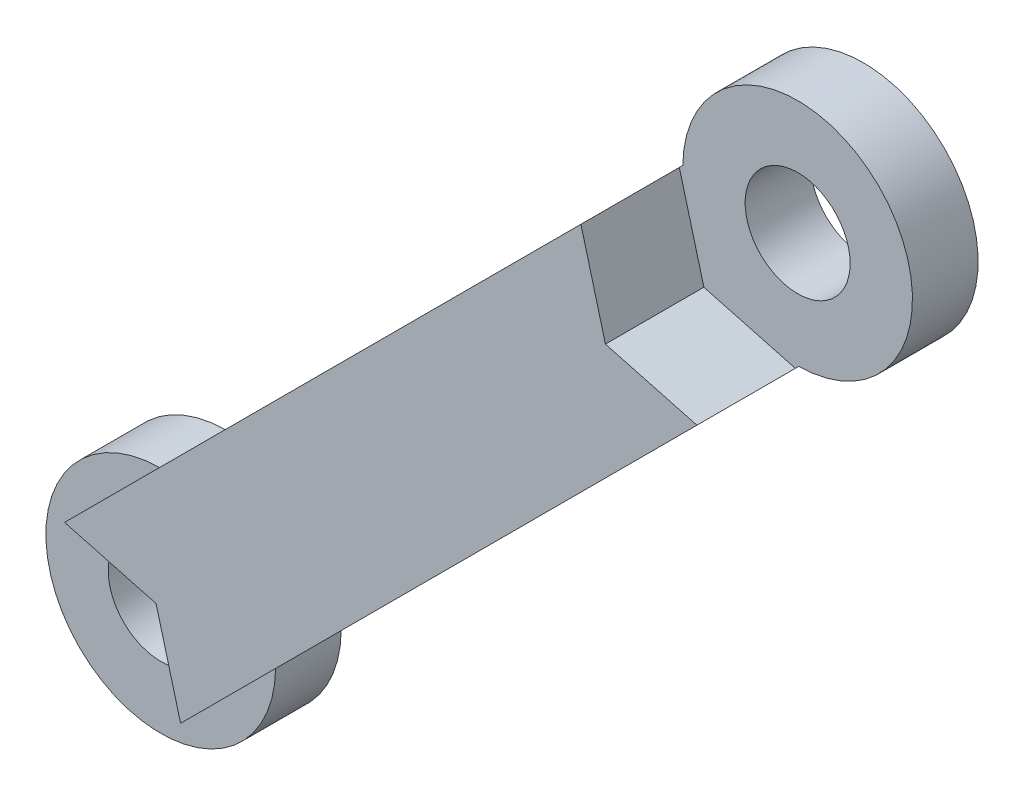
from build123d import *

# Parameters (mm, degrees)
SKETCH1_R           = 1.6
BOSS_EXTRUDE1_DEPTH = 5
CUT_EXTRUDE1_START  = -3
SKETCH2_R           = 1.6
CUT_EXTRUDE1_DEPTH  = 3


with BuildPart() as part:
    # Sketch1 → Boss-Extrude1 (new body)
    with BuildSketch(Plane.XY):
        with BuildLine():
            ThreePointArc((31.466251763, 27.930717857), (33.905409352, 33.905409352), (27.930717857, 31.466251763))
            Line((27.930717857, 31.466251763), (11.985099135, 15.520633041))
            ThreePointArc((11.985099135, 15.520633041), (9.545941546, 9.545941546), (15.520633041, 11.985099135))
            Line((15.520633041, 11.985099135), (31.466251763, 27.930717857))
        make_face()
        with Locations((31.430535617, 31.430535617)):
            Circle(SKETCH1_R, mode=Mode.SUBTRACT)
        with Locations((12.02081528, 12.02081528)):
            Circle(SKETCH1_R, mode=Mode.SUBTRACT)
    extrude(amount=BOSS_EXTRUDE1_DEPTH)

    # Sketch2 → Cut-Extrude1 (cut)
    # profile 1 of 2: a face of its own
    with BuildSketch(Plane.XY.offset(5).offset(CUT_EXTRUDE1_START)):
        with BuildLine():
            ThreePointArc((11.985099135, 15.520633041), (9.545941546, 9.545941546), (15.520633041, 11.985099135))
            Line((15.520633041, 11.985099135), (15.62569954, 12.090165634))
            Line((15.62569954, 12.090165634), (14.878553313, 14.878553313))
            Line((14.878553313, 14.878553313), (12.090165634, 15.62569954))
            Line((12.090165634, 15.62569954), (11.985099135, 15.520633041))
        make_face()
        with Locations((12.02081528, 12.02081528)):
            Circle(SKETCH2_R, mode=Mode.SUBTRACT)
    # profile 2 of 2: a face of its own
    with BuildSketch(Plane.XY.offset(5).offset(CUT_EXTRUDE1_START)):
        with BuildLine():
            Line((28.572797584, 28.572797584), (31.361185263, 27.825651357))
            Line((31.361185263, 27.825651357), (31.466251763, 27.930717857))
            ThreePointArc((31.466251763, 27.930717857), (33.905409352, 33.905409352), (27.930717857, 31.466251763))
            Line((27.930717857, 31.466251763), (27.825651357, 31.361185263))
            Line((27.825651357, 31.361185263), (28.572797584, 28.572797584))
        make_face()
        with Locations((31.430535617, 31.430535617)):
            Circle(SKETCH2_R, mode=Mode.SUBTRACT)
    extrude(amount=CUT_EXTRUDE1_DEPTH, mode=Mode.SUBTRACT)


solid = part.part
